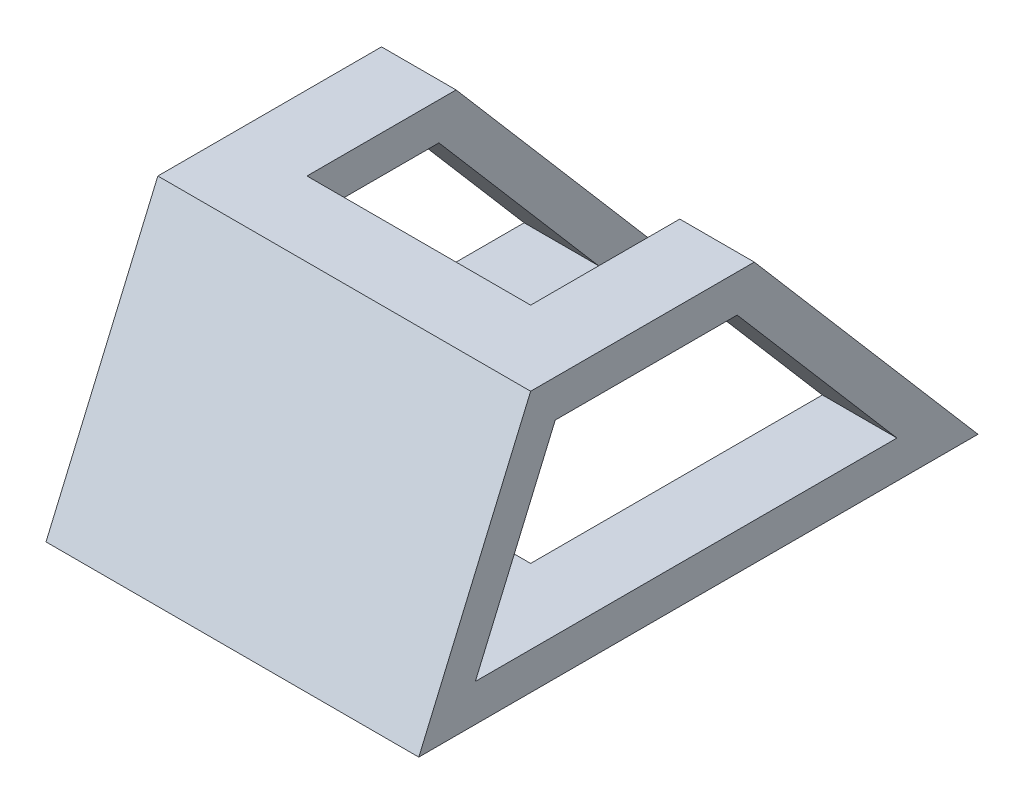
from build123d import *

# Parameters (mm, degrees)
BOSS_EXTRUDE1_DEPTH = 100
CUT_EXTRUDE1_REACH  = 157.72
SKETCH4_W           = 60
SKETCH4_H           = 100


with BuildPart() as part:
    # Sketch2 → Boss-Extrude1 (new body)
    with BuildSketch(Plane(origin=(0, 0, 0), x_dir=(0, 0, -1), z_dir=(1, 0, 0))):
        Polygon((-53.310635803, -27.604086957), (96.689364197, -27.604086957), (36.689364197, 42.395913043), (-23.310635803, 42.395913043), align=None)
        Polygon((32.090014972, 32.395913043), (-16.716674223, 32.395913043), (-38.145245652, -17.604086957), (74.947157829, -17.604086957), align=None, mode=Mode.SUBTRACT)
    extrude(amount=-BOSS_EXTRUDE1_DEPTH)

    # Cut-Extrude1: up to this face of the body (flat: up to its plane)
    cut_extrude1_end = Plane(part.part.faces().sort_by_distance((-50, -27.604086957, -21.689364197))[0])
    # Sketch4 → Cut-Extrude1 (cut, up to the picked face)
    with BuildSketch(Plane(origin=(0, 42.395913043, 0), x_dir=(1, 0, 0), z_dir=(0, 1, 0)), mode=Mode.PRIVATE) as cut_extrude1_sk1:
        with Locations((-50, 46.689364197)):
            Rectangle(SKETCH4_W, SKETCH4_H)
    cut_extrude1_tool1 = split(extrude(cut_extrude1_sk1.sketch, amount=-CUT_EXTRUDE1_REACH, mode=Mode.PRIVATE), bisect_by=cut_extrude1_end, keep=Keep.BOTH, mode=Mode.PRIVATE)
    add(cut_extrude1_tool1.solids().sort_by(Axis((-50, 42.395913, -46.689364), (0, -1, 0)))[0], mode=Mode.SUBTRACT)


solid = part.part
